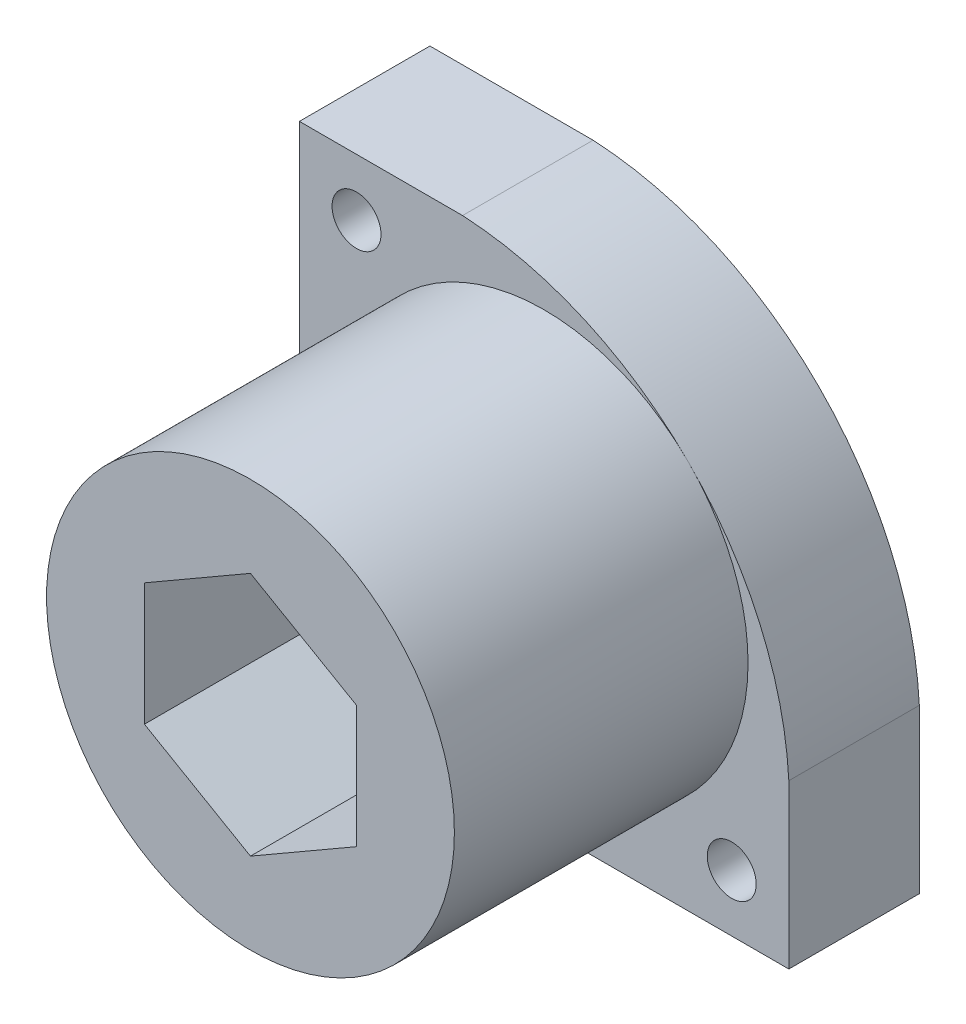
from build123d import *

# Parameters (mm, degrees)
IZIM1_W                     = 30
IZIM1_H                     = 30
Y_KSEKLIK_EKSTR_ZYON1_DEPTH = 8
IZIM2_R                     = 12.5
Y_KSEKLIK_EKSTR_ZYON2_DEPTH = 8
IZIM3_R                     = 5.5
KES_EKSTR_ZYON1_DEPTH       = 8
IZIM4_R                     = 1.5
KES_EKSTR_ZYON2_DEPTH       = 8
IZIM5_R                     = 12.5
Y_KSEKLIK_EKSTR_ZYON3_DEPTH = 10
KES_EKSTR_ZYON3_DEPTH       = 10


with BuildPart() as part:
    # Çizim1 → Yükseklik-Ekstrüzyon1 (new body)
    with BuildSketch(Plane.XY):
        with Locations((15, 15)):
            Rectangle(IZIM1_W, IZIM1_H)
    extrude(amount=Y_KSEKLIK_EKSTR_ZYON1_DEPTH)

    # Çizim2 → Yükseklik-Ekstrüzyon2 (add)
    with BuildSketch(Plane.XY.offset(8)):
        with Locations(Location((15, 15, 0), (0, 0, 180))):
            Circle(IZIM2_R)
        Polygon((15, 22.505553499), (8.5, 18.75277675), (8.5, 11.24722325), (15, 7.494446501), (21.5, 11.24722325), (21.5, 18.75277675), align=None, mode=Mode.SUBTRACT)
    extrude(amount=Y_KSEKLIK_EKSTR_ZYON2_DEPTH)

    # Çizim3 → Kes-Ekstrüzyon1 (cut)
    with BuildSketch(Plane.XY.offset(8)):
        with Locations((15, 15)):
            Circle(IZIM3_R)
    extrude(amount=-KES_EKSTR_ZYON1_DEPTH, mode=Mode.SUBTRACT)

    # Çizim4 → Kes-Ekstrüzyon2 (cut)
    with BuildSketch(Plane.XY.offset(8)):
        with Locations((3.5, 26.5)):
            Circle(IZIM4_R)
        with Locations((26.5, 26.5)):
            Circle(IZIM4_R)
        with Locations((26.5, 3.5)):
            Circle(IZIM4_R)
        with Locations((3.5, 3.5)):
            Circle(IZIM4_R)
    extrude(amount=-KES_EKSTR_ZYON2_DEPTH, mode=Mode.SUBTRACT)

    # Çizim5 → Yükseklik-Ekstrüzyon3 (add)
    with BuildSketch(Plane.XY.offset(16)):
        with Locations(Location((15, 15, 0), (0, 0, 180))):
            Circle(IZIM5_R)
        Polygon((15, 22.505553499), (8.5, 18.75277675), (8.5, 11.24722325), (15, 7.494446501), (21.5, 11.24722325), (21.5, 18.75277675), align=None, mode=Mode.SUBTRACT)
    extrude(amount=Y_KSEKLIK_EKSTR_ZYON3_DEPTH)

    # Çizim6 → Kes-Ekstrüzyon3 (cut)
    with BuildSketch(Plane.XY.offset(8)):
        with BuildLine():
            Line((10, 30), (30, 30))
            Line((30, 30), (30, 10))
            ThreePointArc((30, 10), (23.838834765, 23.838834765), (10, 30))
        make_face()
    extrude(amount=-KES_EKSTR_ZYON3_DEPTH, mode=Mode.SUBTRACT)


solid = part.part
